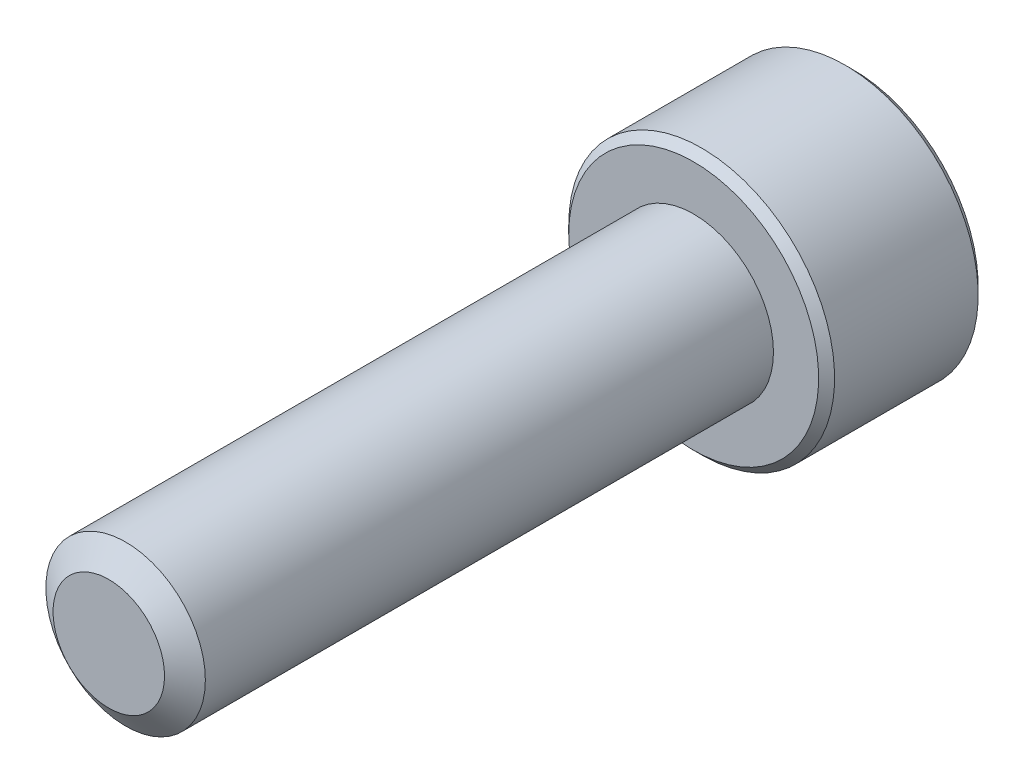
from build123d import *

# Parameters (mm, degrees)
SKETCH1_R          = 3
EXTRUDE1_DEPTH     = 22
SKETCH6_R          = 5
EXTRUDE2_DEPTH     = 6
CUT_EXTRUDE1_DEPTH = 3.75
CHAMFER1_SIZE      = 0.3


with BuildPart() as part:
    # Sketch1 → Extrude1 (new body)
    with BuildSketch(Plane.XY):
        Circle(SKETCH1_R)
    extrude(amount=-EXTRUDE1_DEPTH)

    # Sketch4 → Cut-Revolve1 (revolve, cut)
    with BuildSketch(Plane(origin=(0, 0, 0), x_dir=(0, 0, -1), z_dir=(1, 0, 0))):
        Polygon((0.632650852, 3), (0, 2.096480947), (0, 3), align=None)
    revolve(axis=Axis((0, 0, 0), (0, 0, -1)), mode=Mode.SUBTRACT)

    # Sketch6 → Extrude2 (add)
    with BuildSketch(Plane(origin=(0, 0, -22), x_dir=(-1, 0, 0), z_dir=(0, 0, -1))):
        Circle(SKETCH6_R)
    extrude(amount=EXTRUDE2_DEPTH)

    # Sketch7 → Cut-Extrude1 (cut)
    with BuildSketch(Plane(origin=(0, 0, -28), x_dir=(-1, 0, 0), z_dir=(0, 0, -1))):
        Polygon((0, 2.886751346), (-2.5, 1.443375673), (-2.5, -1.443375673), (0, -2.886751346), (2.5, -1.443375673), (2.5, 1.443375673), align=None)
    extrude(amount=-CUT_EXTRUDE1_DEPTH, mode=Mode.SUBTRACT)

    # Cut-Extrude2 cone 1 section (through the dimple's axis) → Cut-Extrude2 (revolve, cut)
    with BuildSketch(Plane(origin=(0, 0, -28), x_dir=(0, 1, 0), z_dir=(1, 0, 0))):
        Polygon((0, 0), (2.886751346, 0), (0, 2.886751346), align=None)
    revolve(axis=Axis((0, 0, -28), (0, 0, 1)), mode=Mode.SUBTRACT)

    # Chamfer1
    chamfer1_edges = [part.edges().sort_by_distance(p)[0] for p in [
        (5, 0, -28),
        (5, 0, -22),
    ]]
    chamfer(chamfer1_edges, length=CHAMFER1_SIZE)

    # Sketch10 → Revolve1 (revolve)
    with BuildSketch(Plane(origin=(0, 0, 0), x_dir=(0, 0, -1), z_dir=(1, 0, 0))):
        Polygon((22, 3), (22, 0), (20.507359313, 0), (21.75, 3), align=None)
    revolve(axis=Axis((0, 0, -22), (0, 0, 1)))


solid = part.part
